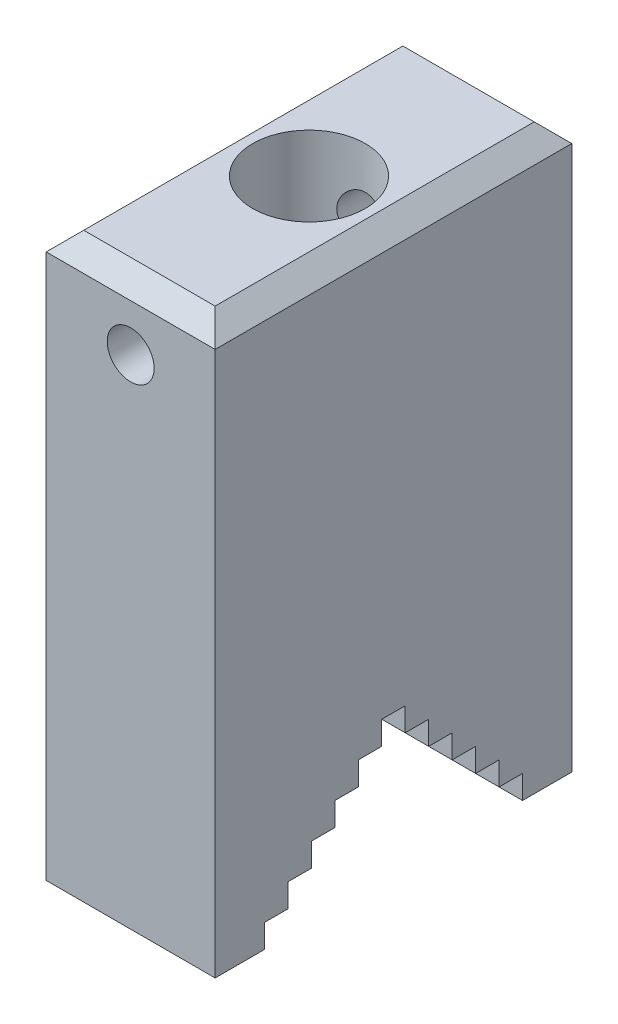
from build123d import *

# Parameters (mm, degrees)
BOSS_EXTRUDE1_DEPTH        = 9
CHAMFER1_SIZE              = 2
F_12_0MM_DOWEL_HOLE1_D     = 12
F_12_0MM_DOWEL_HOLE1_DEPTH = 18
F_12_0MM_DOWEL_HOLE1_TIP   = 3.464101615
M6X1_0_TAPPED_HOLE1_D      = 5


with BuildPart() as part:
    # Sketch1 → Boss-Extrude1 (new, symmetric)
    with BuildSketch(Plane(origin=(0, 0, 0), x_dir=(0, 0, -1), z_dir=(1, 0, 0))):
        Polygon((19, 60), (-19, 60), (-19, 0), (-13.75, 0), (-13.75, 2.5), (-11.25, 2.5), (-11.25, 5), (-8.75, 5), (-8.75, 7.5), (-6.25, 7.5), (-6.25, 10), (-3.75, 10), (-3.75, 12.5), (-1.25, 12.5), (-1.25, 15), (1.25, 15), (1.25, 12.5), (3.75, 12.5), (3.75, 10), (6.25, 10), (6.25, 7.5), (8.75, 7.5), (8.75, 5), (11.25, 5), (11.25, 2.5), (13.75, 2.5), (13.75, 0), (19, 0), align=None)
    extrude(amount=BOSS_EXTRUDE1_DEPTH, both=True)

    # Chamfer1
    chamfer1_edges = [part.edges().sort_by_distance(p)[0] for p in [
        (-9, 60, 0),
        (0, 60, 19),
        (0, 60, -19),
        (9, 60, 0),
    ]]
    chamfer(chamfer1_edges, length=CHAMFER1_SIZE)

    # Ø12.0mm Dowel Hole1
    with Locations(Plane(origin=(0, 60, 0), x_dir=(1, 0, 0), z_dir=(0, 1, 0))):
        with Locations((0, 0)):
            Hole(F_12_0MM_DOWEL_HOLE1_D / 2, depth=F_12_0MM_DOWEL_HOLE1_DEPTH)
            with Locations((0, 0, -(F_12_0MM_DOWEL_HOLE1_DEPTH + F_12_0MM_DOWEL_HOLE1_TIP / 2))):  # 120° drill point
                Cone(0, F_12_0MM_DOWEL_HOLE1_D / 2, F_12_0MM_DOWEL_HOLE1_TIP, mode=Mode.SUBTRACT)

    # M6x1.0 Tapped Hole1 (through all)
    with Locations(Plane.XY.offset(19)):
        with Locations((0, 53)):
            Hole(M6X1_0_TAPPED_HOLE1_D / 2)


solid = part.part
